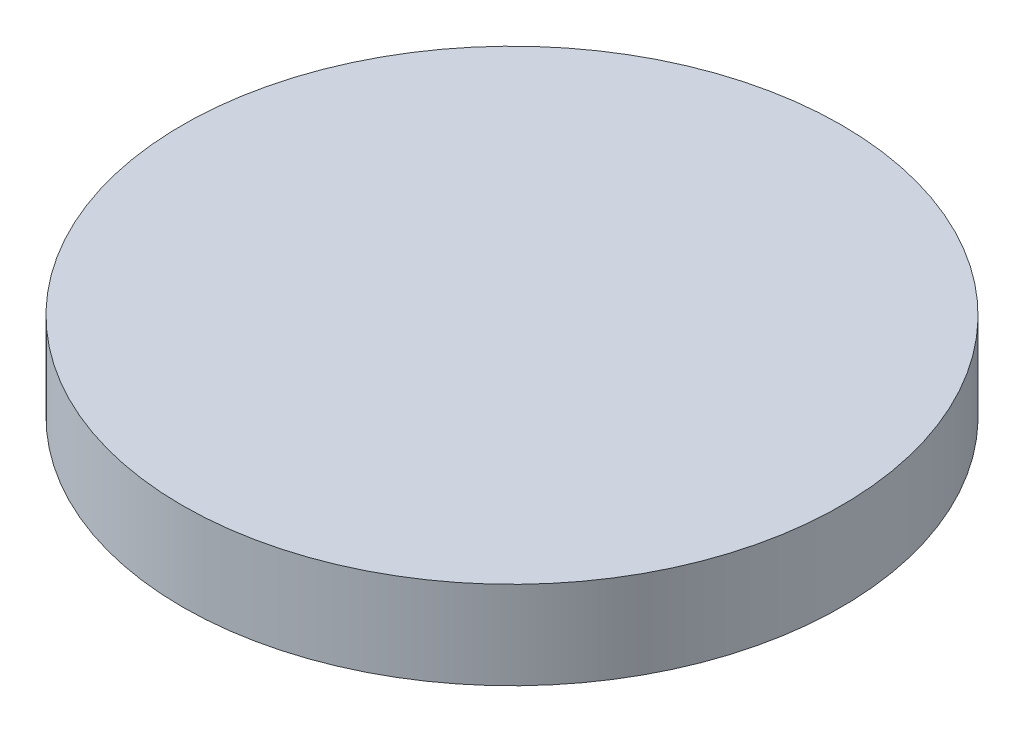
from build123d import *

# Parameters (mm, degrees)
SKETCH1_R           = 19.05
BOSS_EXTRUDE1_DEPTH = 5.08


with BuildPart() as part:
    # Sketch1 → Boss-Extrude1 (new body)
    with BuildSketch(Plane(origin=(0, 0, 0), x_dir=(1, 0, 0), z_dir=(0, 1, 0))):
        with Locations(Location((0, 0, 0), (0, 0, 270))):
            Circle(SKETCH1_R)
    extrude(amount=BOSS_EXTRUDE1_DEPTH)


solid = part.part
